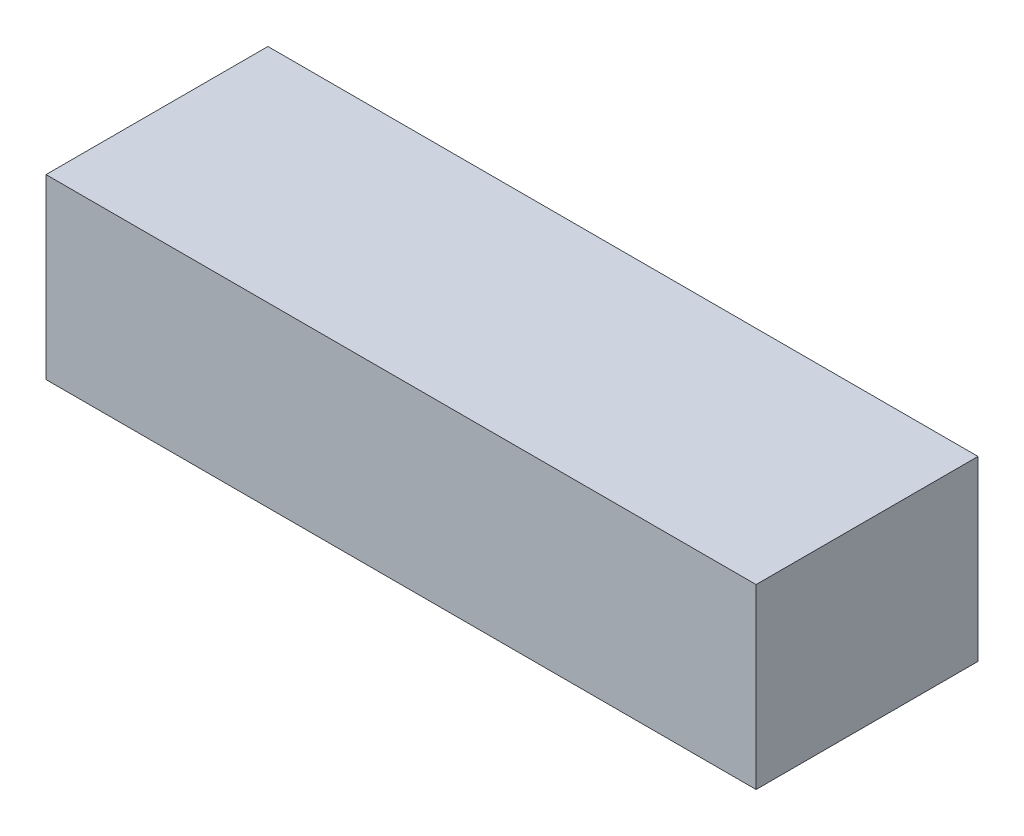
from build123d import *

# Parameters (mm, degrees)
SKETCH1_W           = 101.6
SKETCH1_H           = 25.4
BOSS_EXTRUDE1_DEPTH = 31.75


with BuildPart() as part:
    # Sketch1 → Boss-Extrude1 (new body)
    with BuildSketch(Plane.XY):
        with Locations((50.8, -12.7)):
            Rectangle(SKETCH1_W, SKETCH1_H)
    extrude(amount=BOSS_EXTRUDE1_DEPTH)


solid = part.part
